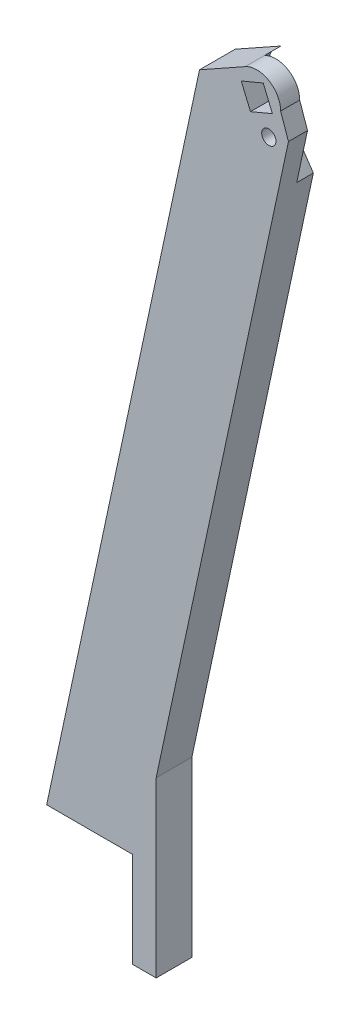
from build123d import *

# Parameters (mm, degrees)
BOSS_EXTRUDE1_DEPTH = 9.525
CUT_EXTRUDE1_START  = -4.445
CUT_EXTRUDE1_DEPTH  = 4.445
SKETCH4_R           = 1.905
CUT_EXTRUDE2_DEPTH  = 228.118627562


with BuildPart() as part:
    # Sketch1 → Boss-Extrude1 (new body)
    with BuildSketch(Plane.XY):
        with BuildLine():
            Line((0, 0), (0, 25.4))
            Line((0, 25.4), (-22.86, 25.4))
            Line((-22.86, 25.4), (17.910019334, 215.579524422))
            Line((17.910019334, 215.579524422), (30.10047331, 222.402553944))
            ThreePointArc((30.10047331, 222.402553944), (36.413450877, 222.339405473), (39.551850365, 216.861438501))
            Line((39.551850365, 216.861438501), (41.637943134, 210.86387925))
            Line((41.637943134, 210.86387925), (6.35, 46.256543942))
            Line((6.35, 46.256543942), (6.35, 0))
            Line((6.35, 0), (0, 0))
        make_face()
    extrude(amount=BOSS_EXTRUDE1_DEPTH)

    # Sketch2 → Cut-Extrude1 (cut)
    with BuildSketch(Plane(origin=(0, 0, 0), x_dir=(-1, 0, 0), z_dir=(0, 0, -1)).offset(CUT_EXTRUDE1_START)):
        with BuildLine():
            Line((-41.637943134, 210.86387925), (-39.551850365, 216.861438501))
            ThreePointArc((-39.551850365, 216.861438501), (-31.336031581, 222.931135385), (-27.948316423, 213.29452371))
            Line((-27.948316423, 213.29452371), (-38.748816351, 197.386996815))
            Line((-38.748816351, 197.386996815), (-41.637943134, 210.86387925))
        make_face()
    extrude(amount=CUT_EXTRUDE1_DEPTH, mode=Mode.SUBTRACT)

    # Sketch4 → Cut-Extrude2 (cut, through all)
    with BuildSketch(Plane(origin=(0, 0, 4.445), x_dir=(-1, 0, 0), z_dir=(0, 0, -1))):
        with Locations((-36.399614201, 209.250963387)):
            Circle(SKETCH4_R)
        Polygon((-29.044835385, 218.558635146), (-31.50465372, 212.70442352), (-37.358865346, 215.164241855), (-34.89904701, 221.018453481), align=None)
    extrude(amount=-CUT_EXTRUDE2_DEPTH, mode=Mode.SUBTRACT)


solid = part.part
